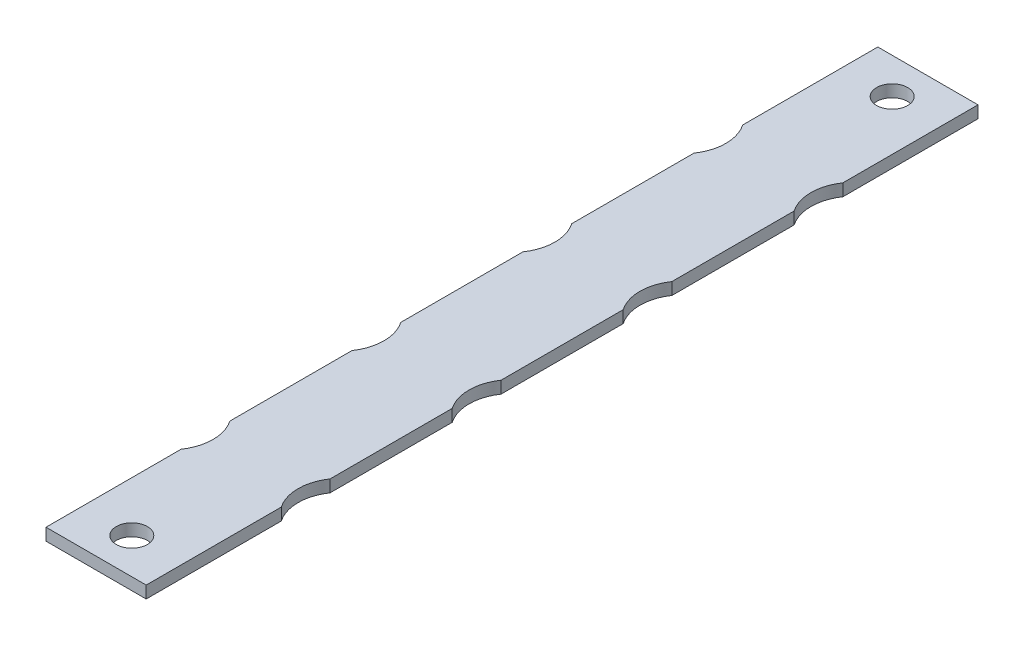
from build123d import *

# Parameters (mm, degrees)
SKETCH1_W           = 13.25
SKETCH1_H           = 110.001600164
BOSS_EXTRUDE1_DEPTH = 1.6002
SKETCH2_R           = 2.0574
CUT_EXTRUDE1_DEPTH  = 111.808281183
SKETCH3_R           = 5.699999998
CUT_EXTRUDE2_DEPTH  = 111.808281183


with BuildPart() as part:
    # Sketch1 → Boss-Extrude1 (new body)
    with BuildSketch(Plane(origin=(0, 0, 0), x_dir=(1, 0, 0), z_dir=(0, 1, 0))):
        with Locations((6.625, 55.000800082)):
            Rectangle(SKETCH1_W, SKETCH1_H)
    extrude(amount=BOSS_EXTRUDE1_DEPTH)

    # Sketch2 → Cut-Extrude1 (cut, through all)
    with BuildSketch(Plane(origin=(0, 1.6002, 0), x_dir=(1, 0, 0), z_dir=(0, 1, 0))):
        with Locations(Location((6.625, 4.7244, 0), (0, 0, 270))):
            Circle(SKETCH2_R)
        with Locations(Location((6.625, 105.277200164, 0), (0, 0, 270))):
            Circle(SKETCH2_R)
    extrude(amount=-CUT_EXTRUDE1_DEPTH, mode=Mode.SUBTRACT)

    # Sketch3 → Cut-Extrude2 (cut, through all)
    with BuildSketch(Plane(origin=(0, 1.6002, 0), x_dir=(1, 0, 0), z_dir=(0, 1, 0))):
        with Locations((-4.699999998, 88.909788652)):
            Circle(SKETCH3_R)
        with Locations((-4.699999998, 66.303788652)):
            Circle(SKETCH3_R)
        with Locations((-4.699999998, 43.697788652)):
            Circle(SKETCH3_R)
        with Locations((-4.699999998, 21.091788652)):
            Circle(SKETCH3_R)
        with Locations((17.949999998, 21.091788652)):
            Circle(SKETCH3_R)
        with Locations((17.949999998, 43.697788652)):
            Circle(SKETCH3_R)
        with Locations((17.949999998, 66.303788652)):
            Circle(SKETCH3_R)
        with Locations((17.949999998, 88.909788652)):
            Circle(SKETCH3_R)
    extrude(amount=-CUT_EXTRUDE2_DEPTH, mode=Mode.SUBTRACT)


solid = part.part
